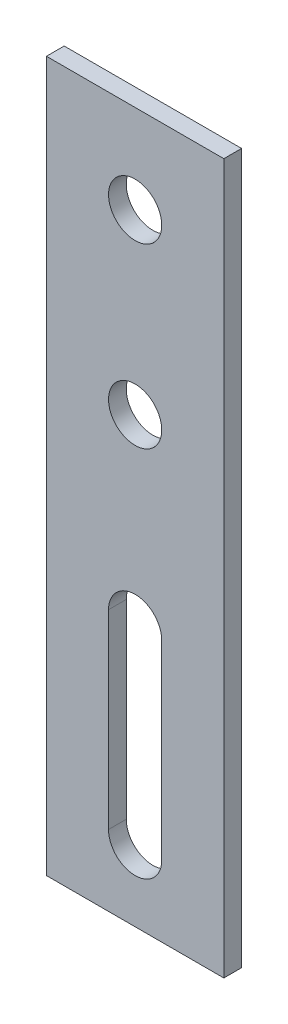
from build123d import *

# Parameters (mm, degrees)
SZKIC1_W                    = 20
SZKIC1_H                    = 80
SZKIC1_R                    = 3
DODANIE_WYCI_GNI_CIE1_DEPTH = 2


with BuildPart() as part:
    # Szkic1 → Dodanie-wyciągnięcie1 (new body)
    with BuildSketch(Plane.XY):
        with Locations((-3.358935359, 7.816091954)):
            Rectangle(SZKIC1_W, SZKIC1_H)
        with Locations((-3.358935359, 37.816091954)):
            Circle(SZKIC1_R, mode=Mode.SUBTRACT)
        with Locations((-3.358935359, 17.816091954)):
            Circle(SZKIC1_R, mode=Mode.SUBTRACT)
        with BuildLine():
            Line((-6.358935359, -24.183908046), (-6.358935359, -2.722651044))
            ThreePointArc((-6.358935359, -2.722651044), (-3.358935359, 0.277348956), (-0.358935359, -2.722651044))
            Line((-0.358935359, -2.722651044), (-0.358935359, -24.183908046))
            ThreePointArc((-0.358935359, -24.183908046), (-3.358935359, -27.183908046), (-6.358935359, -24.183908046))
        make_face(mode=Mode.SUBTRACT)
    extrude(amount=DODANIE_WYCI_GNI_CIE1_DEPTH)


solid = part.part
